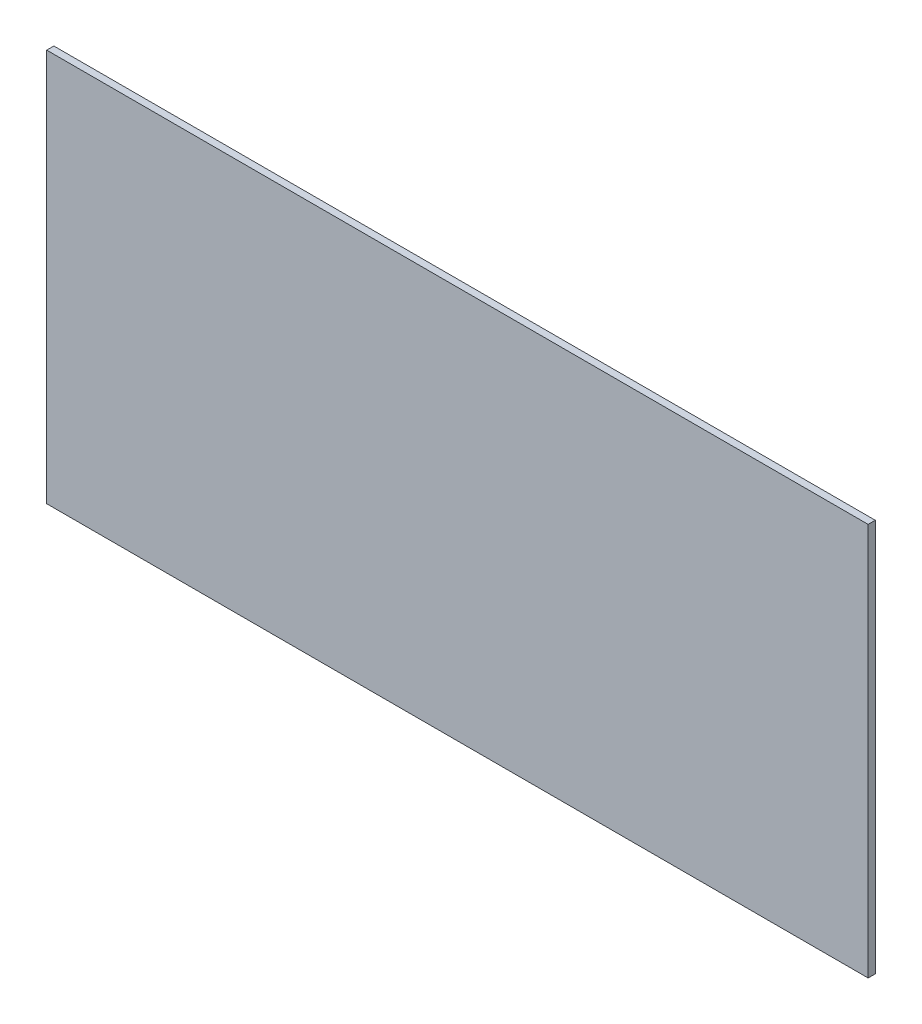
from build123d import *

# Parameters (mm, degrees)
SKETCH1_W           = 230
SKETCH1_H           = 110
BOSS_EXTRUDE1_DEPTH = 2


with BuildPart() as part:
    # Sketch1 → Boss-Extrude1 (new body)
    with BuildSketch(Plane.XY):
        with Locations((-103.29015544, 39.896373057)):
            Rectangle(SKETCH1_W, SKETCH1_H)
    extrude(amount=BOSS_EXTRUDE1_DEPTH)


solid = part.part
